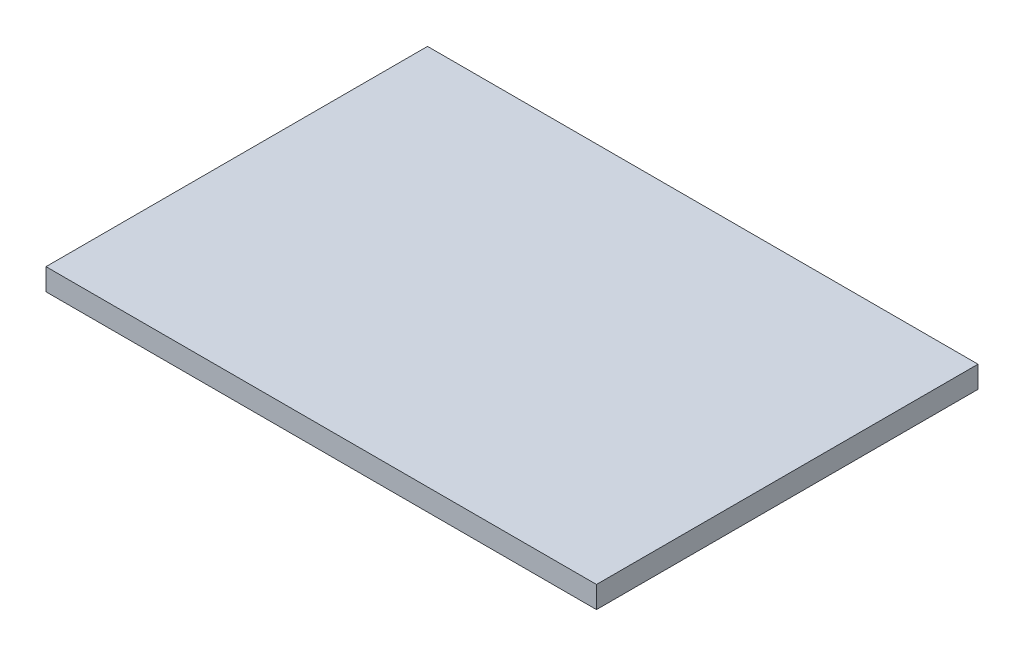
from build123d import *

# Parameters (mm, degrees)
SKETCH1_W           = 700
SKETCH1_H           = 40
BOSS_EXTRUDE1_DEPTH = 505


with BuildPart() as part:
    # Sketch1 → Boss-Extrude1 (new, symmetric)
    with BuildSketch(Plane(origin=(0, 0, 0), x_dir=(0, 0, -1), z_dir=(1, 0, 0))):
        Rectangle(SKETCH1_W, SKETCH1_H)
    extrude(amount=BOSS_EXTRUDE1_DEPTH, both=True)


solid = part.part
